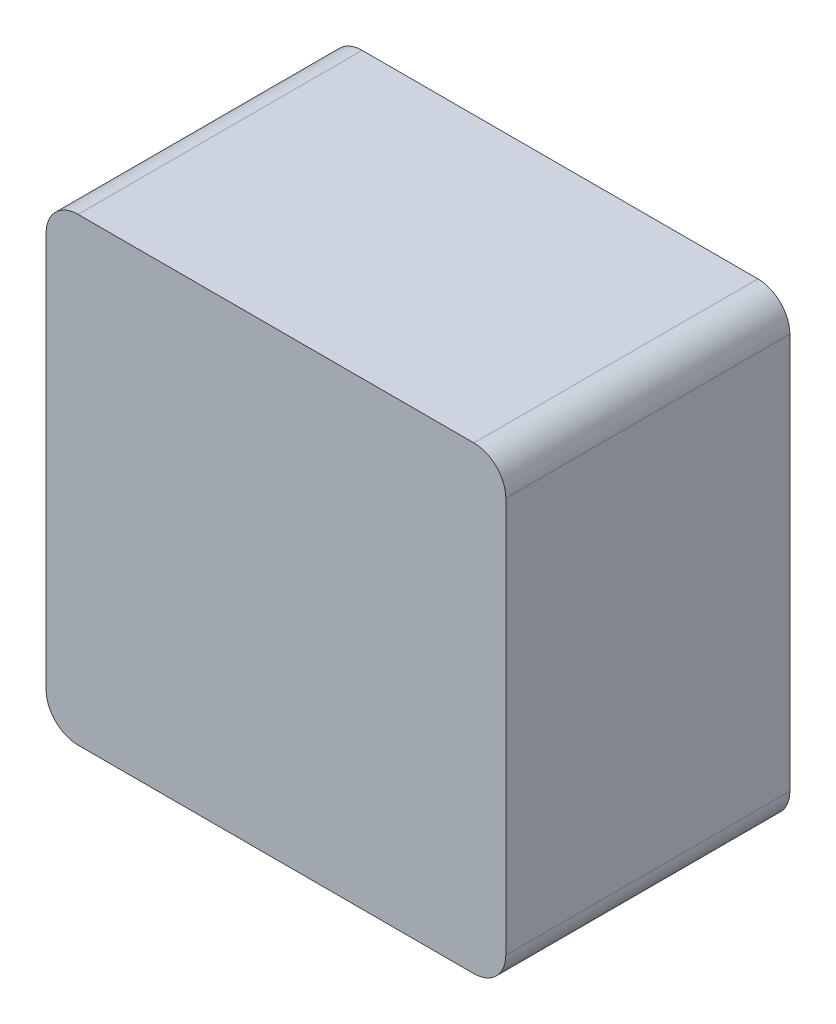
from build123d import *

# Parameters (mm, degrees)
SKETCH_1_W          = 72
SKETCH_1_H          = 72
EXTRUDE_1_DEPTH     = 44.5
SKETCH_4_R          = 2.5
SKETCH_4_W          = 10
SKETCH_4_H          = 15
SKETCH_4_W_2        = 6
SKETCH_4_H_2        = 13
CUT_EXTRUDE_2_DEPTH = 10
FILLET_1_R          = 5
SKETCH_2_R          = 1.05
CUT_EXTRUDE_1_DEPTH = 5
SKETCH_3_R          = 4
SKETCH_3_R_2        = 2.25
EXTRUDE_2_DEPTH     = 1


with BuildPart() as part:
    # 草图1 → 凸台-拉伸1 (new body)
    with BuildSketch(Plane.XY):
        Rectangle(SKETCH_1_W, SKETCH_1_H)
    extrude(amount=EXTRUDE_1_DEPTH)

    # 草图4 → 切除-拉伸2 (cut)
    with BuildSketch(Plane.ZY.offset(36)):
        with Locations((10, 22.5)):
            Circle(SKETCH_4_R)
        with Locations((9, 3.5)):
            Rectangle(SKETCH_4_W, SKETCH_4_H)
        Polygon((18, -11), (18, -26), (21, -26), (23.826446608, -23.5), (23.826446608, -13.5), (21, -11), align=None)
        with Locations((8, -19.5)):
            Rectangle(SKETCH_4_W_2, SKETCH_4_H_2)
        Polygon((18, 10.5), (18, -4.5), (21, -4.5), (23.826446608, -2), (23.826446608, 8), (21, 10.5), align=None)
    extrude(amount=-CUT_EXTRUDE_2_DEPTH, mode=Mode.SUBTRACT)

    # 圆角1
    fillet_1_edges = [part.edges().sort_by_distance(p)[0] for p in [
        (36, -36, 22.25),
        (-36, -36, 22.25),
        (-36, 36, 22.25),
        (36, 36, 22.25),
    ]]
    fillet(fillet_1_edges, radius=FILLET_1_R)

    # 草图2 → 切除-拉伸1 (cut)
    with BuildSketch(Plane(origin=(0, 0, 0), x_dir=(-1, 0, 0), z_dir=(0, 0, -1))):
        with Locations((0, 27.5)):
            Circle(SKETCH_2_R)
        with Locations((0, -27.5)):
            Circle(SKETCH_2_R)
    extrude(amount=-CUT_EXTRUDE_1_DEPTH, mode=Mode.SUBTRACT)

    # 草图3 → 凸台-拉伸2 (add)
    # profile 1 of 4: a face of its own
    with BuildSketch(Plane(origin=(0, 0, 0), x_dir=(-1, 0, 0), z_dir=(0, 0, -1))):
        with Locations(Location((29.5, -29.5, 0), (0, 0, 180))):
            Circle(SKETCH_3_R)
        with Locations((29.5, -29.5)):
            Circle(SKETCH_3_R_2, mode=Mode.SUBTRACT)
    # profile 2 of 4: a face of its own
    with BuildSketch(Plane(origin=(0, 0, 0), x_dir=(-1, 0, 0), z_dir=(0, 0, -1))):
        with Locations(Location((-29.5, -29.5, 0), (0, 0, 180))):
            Circle(SKETCH_3_R)
        with Locations((-29.5, -29.5)):
            Circle(SKETCH_3_R_2, mode=Mode.SUBTRACT)
    # profile 3 of 4: a face of its own
    with BuildSketch(Plane(origin=(0, 0, 0), x_dir=(-1, 0, 0), z_dir=(0, 0, -1))):
        with Locations(Location((-29.5, 29.5, 0), (0, 0, 180))):
            Circle(SKETCH_3_R)
        with Locations((-29.5, 29.5)):
            Circle(SKETCH_3_R_2, mode=Mode.SUBTRACT)
    # profile 4 of 4: a face of its own
    with BuildSketch(Plane(origin=(0, 0, 0), x_dir=(-1, 0, 0), z_dir=(0, 0, -1))):
        with Locations(Location((29.5, 29.5, 0), (0, 0, 180))):
            Circle(SKETCH_3_R)
        with Locations((29.5, 29.5)):
            Circle(SKETCH_3_R_2, mode=Mode.SUBTRACT)
    extrude(amount=EXTRUDE_2_DEPTH)


solid = part.part
